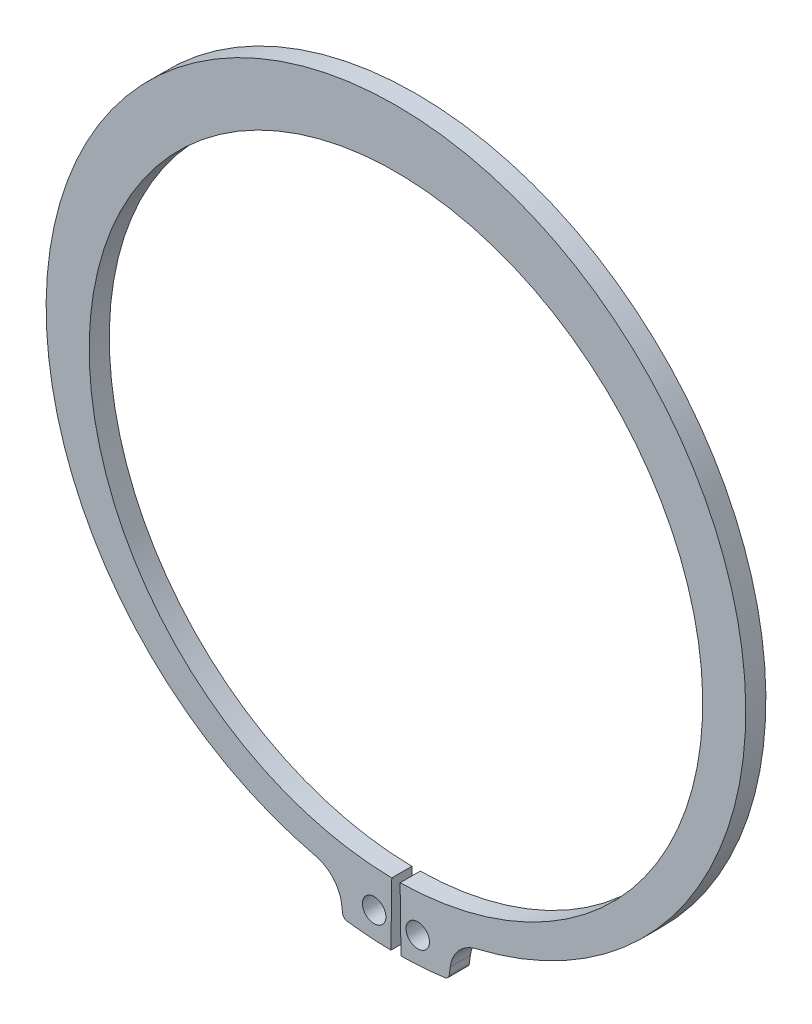
from build123d import *

# Parameters (mm, degrees)
BODYSKE_R  = 1.75
BODY_DEPTH = 3


with BuildPart() as part:
    # BodySke → Body (new body)
    with BuildSketch(Plane.XY):
        with BuildLine():
            Line((0.622166818, -45.745769296), (0.75, -55.144900036))
            ThreePointArc((0.75, -55.144900036), (4.03472129, -55.002213811), (7.305102938, -54.664046421))
            ThreePointArc((7.305102938, -54.664046421), (7.73660562, -54.450467921), (7.949342482, -54.018549681))
            Line((7.949342482, -54.018549681), (8.097556595, -52.892751728))
            ThreePointArc((8.097556595, -52.892751728), (9.370440142, -50.138665895), (11.982380388, -48.594972452))
            ThreePointArc((11.982380388, -48.594972452), (0, 54.35), (-11.982380388, -48.594972452))
            ThreePointArc((-11.982380388, -48.594972452), (-9.370440142, -50.138665895), (-8.097556595, -52.892751728))
            Line((-8.097556595, -52.892751728), (-7.949342482, -54.018549681))
            ThreePointArc((-7.949342482, -54.018549681), (-7.73660562, -54.450467921), (-7.305102938, -54.664046421))
            ThreePointArc((-7.305102938, -54.664046421), (-4.03472129, -55.002213811), (-0.75, -55.144900036))
            Line((-0.75, -55.144900036), (-0.622166818, -45.745769296))
            ThreePointArc((-0.622166818, -45.745769296), (0, 45.75), (0.622166818, -45.745769296))
        make_face()
        with Locations((3.25, -51.221998448)):
            Circle(BODYSKE_R, mode=Mode.SUBTRACT)
        with Locations((-3.25, -51.221998448)):
            Circle(BODYSKE_R, mode=Mode.SUBTRACT)
    extrude(amount=-BODY_DEPTH)


solid = part.part
